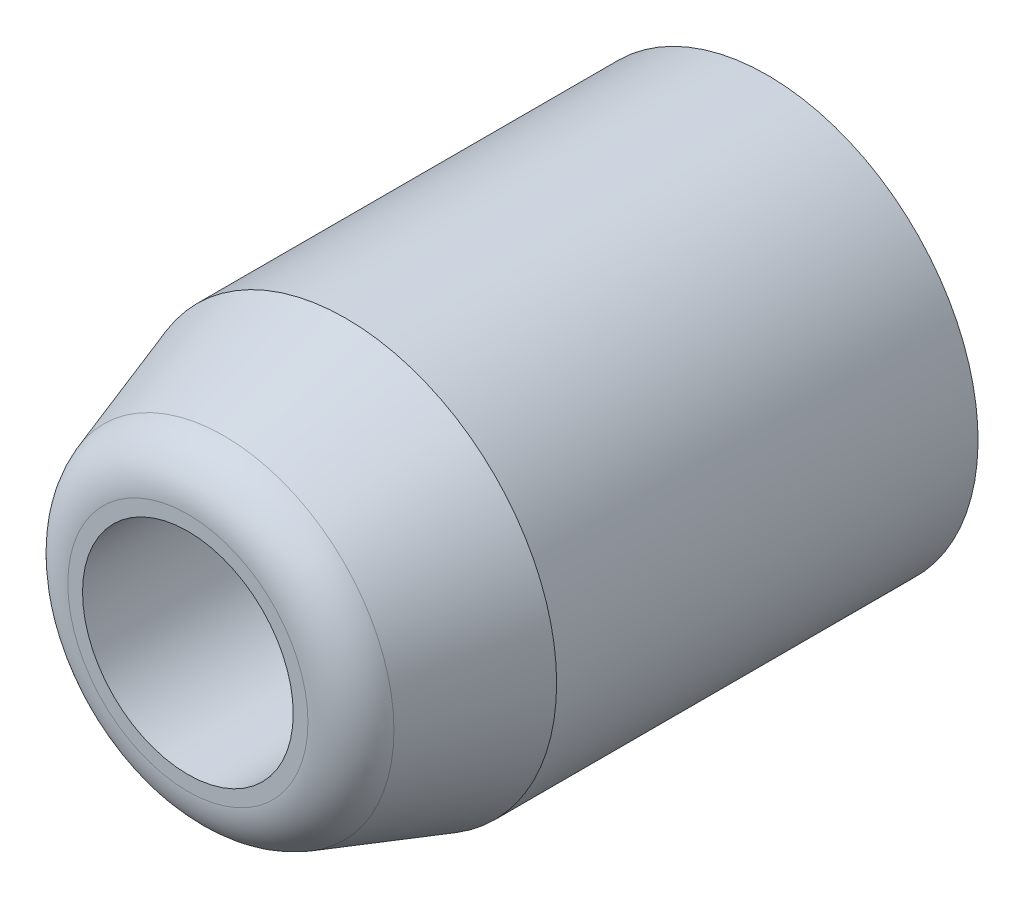
from build123d import *

# Parameters (mm, degrees)
SKETCH1_R           = 4
SKETCH1_R_2         = 3
BOSS_EXTRUDE1_DEPTH = 8
SKETCH2_R           = 4
SKETCH3_R           = 3
SKETCH4_R           = 2
CUT_EXTRUDE1_DEPTH  = 13.369316942
FILLET1_R           = 1
SKETCH5_W           = 5
SKETCH5_H           = 2
CUT_EXTRUDE2_DEPTH  = 6


with BuildPart() as part:
    # Sketch1 → Boss-Extrude1 (new body)
    with BuildSketch(Plane.XY):
        Circle(SKETCH1_R)
        Circle(SKETCH1_R_2, mode=Mode.SUBTRACT)
    extrude(amount=BOSS_EXTRUDE1_DEPTH)

    # Sketch2 → Loft1 section 0
    with BuildSketch(Plane.XY.offset(8)):
        Circle(SKETCH2_R)
    # Sketch3 → Loft1 section 1
    with BuildSketch(Plane.XY.offset(11)):
        Circle(SKETCH3_R)
    loft()

    # Sketch4 → Cut-Extrude1 (cut, through all)
    with BuildSketch(Plane.XY.offset(11)):
        Circle(SKETCH4_R)
    extrude(amount=-CUT_EXTRUDE1_DEPTH, mode=Mode.SUBTRACT)

    # Fillet1
    fillet1_edges = [part.edges().sort_by_distance(p)[0] for p in [
        (-3, 0, 11),
    ]]
    fillet(fillet1_edges, radius=FILLET1_R)

    # Sketch5 → Cut-Extrude2 (cut)
    with BuildSketch(Plane(origin=(0, 0, 0), x_dir=(1, 0, 0), z_dir=(0, 1, 0))):
        with Locations((-0.5, -1)):
            Rectangle(SKETCH5_W, SKETCH5_H)
    extrude(amount=-CUT_EXTRUDE2_DEPTH, mode=Mode.SUBTRACT)


solid = part.part
